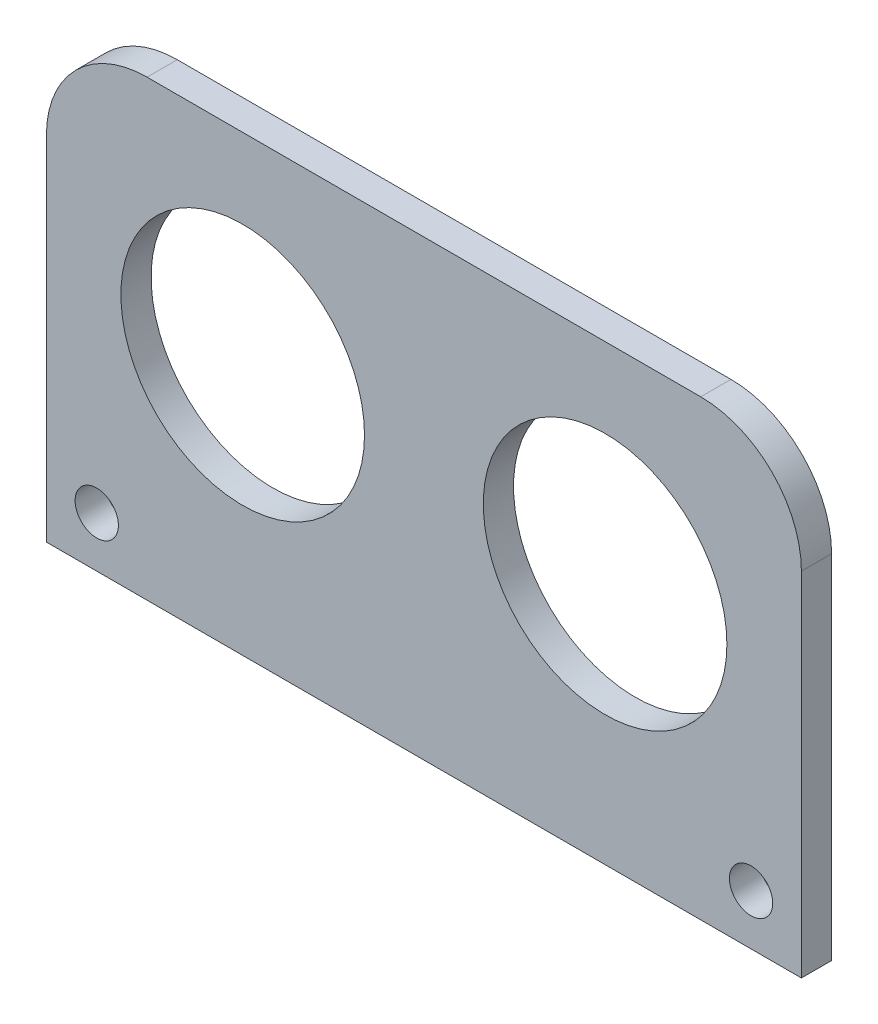
from build123d import *

# Parameters (mm, degrees)
SKETCH_1_W      = 75
SKETCH_1_H      = 45
SKETCH_1_R      = 12.1
SKETCH_1_R_2    = 2.15
EXTRUDE_1_DEPTH = 3
FILLET_1_R      = 10


with BuildPart() as part:
    # ｽｹｯﾁ1 → ﾎﾞｽ - 押し出し1 (new body)
    with BuildSketch(Plane.XY):
        with Locations((37.5, 22.5)):
            Rectangle(SKETCH_1_W, SKETCH_1_H)
        with Locations((19.5, 25)):
            Circle(SKETCH_1_R, mode=Mode.SUBTRACT)
        with Locations((55.5, 25)):
            Circle(SKETCH_1_R, mode=Mode.SUBTRACT)
        with Locations((5, 5)):
            Circle(SKETCH_1_R_2, mode=Mode.SUBTRACT)
        with Locations(Location((70, 5, 0), (0, 0, 180))):
            Circle(SKETCH_1_R_2, mode=Mode.SUBTRACT)
    extrude(amount=EXTRUDE_1_DEPTH)

    # ﾌｨﾚｯﾄ1
    fillet_1_edges = [part.edges().sort_by_distance(p)[0] for p in [
        (0, 45, 1.5),
        (75, 45, 1.5),
    ]]
    fillet(fillet_1_edges, radius=FILLET_1_R)


solid = part.part
